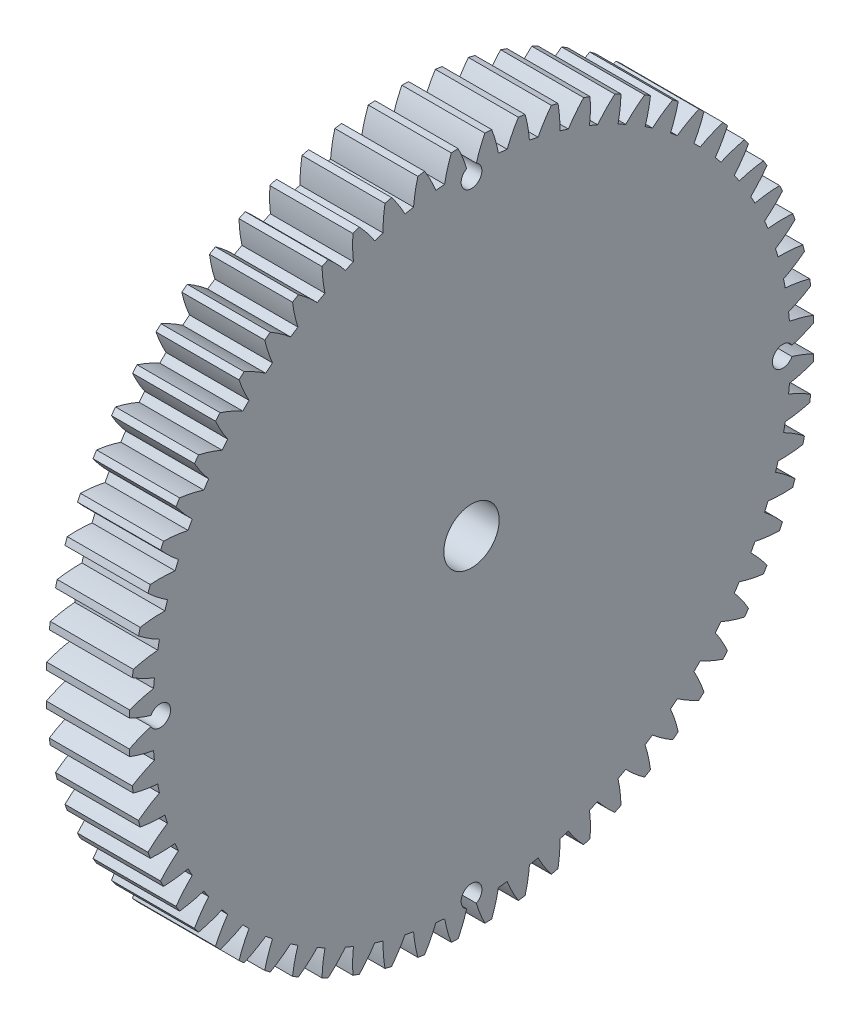
from build123d import *

# Parameters (mm, degrees)
BASPROSKE_W        = 12
BASPROSKE_H        = 49.5
TOOTHCUT_DEPTH     = 72.024643611
TEETHCUTS_COUNT    = 64
TEETHCUTS_ANGLE    = 354.375
BORSKE_R           = 4
BORE_DEPTH         = 50.0000508
SKETCH3_R          = 1.5
CUT_EXTRUDE1_DEPTH = 71.9718959


with BuildPart() as part:
    # BasProSke → Base-Revolve (revolve)
    with BuildSketch(Plane(origin=(0, 0, 0), x_dir=(1, 0, 0), z_dir=(0, 1, 0)), mode=Mode.PRIVATE) as base_revolve_sk:
        with Locations((6, 24.75)):
            Rectangle(BASPROSKE_W, BASPROSKE_H)
    revolve(base_revolve_sk.sketch.rotate(Axis((-10, 0, 0), (1, 0, 0)), 180), axis=Axis((-10, 0, 0), (1, 0, 0)))

    # TooCutSke → ToothCut (cut, through all)
    with BuildSketch(Plane(origin=(0, 0, 0), x_dir=(0, 0, -1), z_dir=(1, 0, 0))):
        with BuildLine():
            ThreePointArc((0.635076871, 46.119627637), (0, 46.124), (-0.635076871, 46.119627637))
            ThreePointArc((-0.635076871, 46.119627637), (-1.211981228, 47.834312084), (-1.947712443, 49.487085804))
            ThreePointArc((-1.947712443, 49.487085804), (0, 49.5254), (1.947712443, 49.487085804))
            ThreePointArc((1.947712443, 49.487085804), (1.211981228, 47.834312084), (0.635076871, 46.119627637))
        make_face()
    toothcut = extrude(amount=TOOTHCUT_DEPTH, mode=Mode.SUBTRACT)

    # TeethCuts: ToothCut ×64 about axis
    teethcuts_axis = Axis((-10, 0, 0), (1, 0, 0))
    for i in range(1, TEETHCUTS_COUNT):
        add(toothcut.rotate(teethcuts_axis, i * TEETHCUTS_ANGLE / (TEETHCUTS_COUNT - 1)), mode=Mode.SUBTRACT)

    # BorSke → Bore (cut, symmetric)
    with BuildSketch(Plane(origin=(0, 0, 0), x_dir=(0, 0, -1), z_dir=(1, 0, 0))):
        with Locations(Location((0, 0, 0), (0, 0, 180))):
            Circle(BORSKE_R)
    extrude(amount=BORE_DEPTH, both=True, mode=Mode.SUBTRACT)

    # Sketch3 → Cut-Extrude1 (cut, through all)
    with BuildSketch(Plane(origin=(12, 0, 0), x_dir=(0, 0, -1), z_dir=(1, 0, 0))):
        with Locations((0, 45)):
            Circle(SKETCH3_R)
        with Locations((45, 0)):
            Circle(SKETCH3_R)
        with Locations((0, -45)):
            Circle(SKETCH3_R)
        with Locations((-45, 0)):
            Circle(SKETCH3_R)
    extrude(amount=-CUT_EXTRUDE1_DEPTH, mode=Mode.SUBTRACT)


solid = part.part
